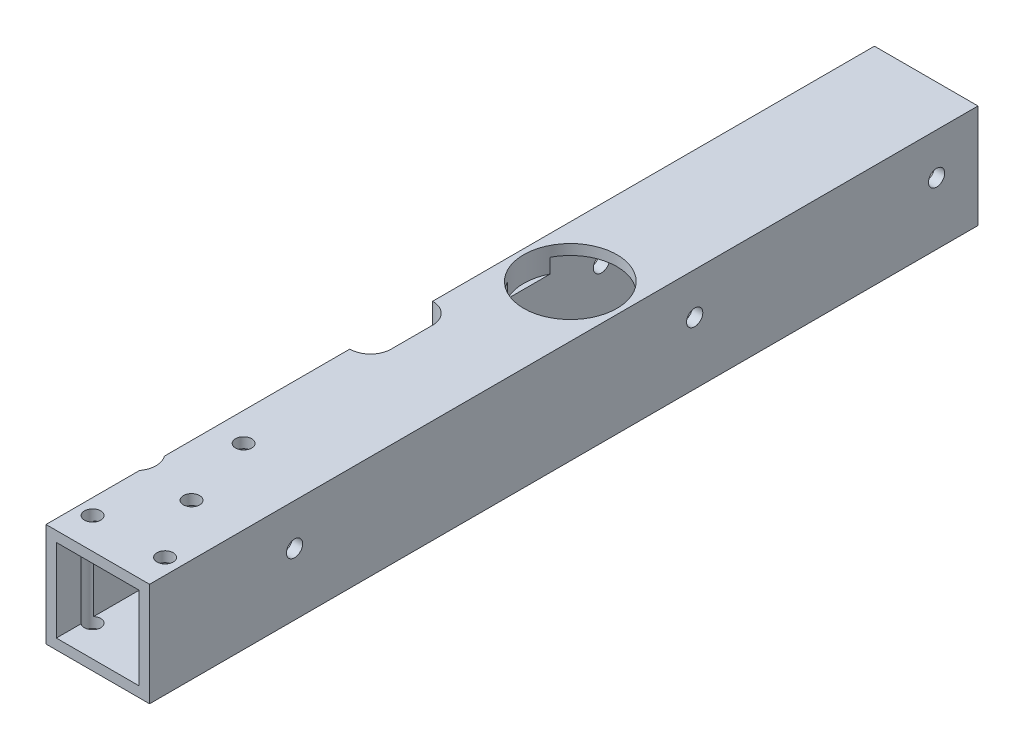
from build123d import *

# Parameters (mm, degrees)
BOSS_EXTRUDE1_DEPTH      = 127
BOSS_EXTRUDE1_DEPTH_BACK = 127
SKETCH3_W                = 31.75
SKETCH3_H                = 31.75
SKETCH3_W_2              = 25.4
SKETCH3_H_2              = 25.4
F_10_CLEARANCE_HOLE1_D   = 4.9784
SKETCH7_R                = 14.2875
CUT_EXTRUDE1_DEPTH       = 7.62
CUT_EXTRUDE2_START       = -7.62
SKETCH8_R                = 14.2875
CUT_EXTRUDE2_DEPTH       = 7.62
CUT_EXTRUDE3_DEPTH       = 132.867653824
F_10_CLEARANCE_HOLE2_D   = 4.9784
SKETCH13_R               = 6.35
CUT_EXTRUDE4_DEPTH       = 132.867653824


with BuildPart() as part:
    # Sketch3 → Boss-Extrude1 (new, two sides: drawn at the far end of the back side and taken through both)
    with BuildSketch(Plane.XY.offset(-BOSS_EXTRUDE1_DEPTH_BACK)):
        Rectangle(SKETCH3_W, SKETCH3_H)
        Rectangle(SKETCH3_W_2, SKETCH3_H_2, mode=Mode.SUBTRACT)
    extrude(amount=BOSS_EXTRUDE1_DEPTH + BOSS_EXTRUDE1_DEPTH_BACK)

    # #10 Clearance Hole1 (through all)
    with Locations(Plane(origin=(0, 15.875, 0), x_dir=(1, 0, 0), z_dir=(0, 1, 0))):
        with Locations((-11.1125, -117.475), (11.1125, -117.475), (0, -98.247200001), (-7.111939052, -75.171256705)):
            Hole(F_10_CLEARANCE_HOLE1_D / 2)

    # Sketch7 → Cut-Extrude1 (cut)
    with BuildSketch(Plane(origin=(0, 15.875, 0), x_dir=(1, 0, 0), z_dir=(0, 1, 0))):
        with Locations(Location((0, 17.8816, 0), (0, 0, 270))):
            Circle(SKETCH7_R)
    extrude(amount=-CUT_EXTRUDE1_DEPTH, mode=Mode.SUBTRACT)

    # Sketch8 → Cut-Extrude2 (cut)
    with BuildSketch(Plane.XZ.offset(15.875).offset(CUT_EXTRUDE2_START)):
        with Locations(Location((0, -17.8816, 0), (0, 0, 90))):
            Circle(SKETCH8_R)
    extrude(amount=CUT_EXTRUDE2_DEPTH, mode=Mode.SUBTRACT)

    # Sketch9 → Cut-Extrude3 (cut, through all)
    with BuildSketch(Plane.XZ.offset(15.875)):
        with BuildLine():
            Line((-9.525, 27.51353779), (-9.525, 14.81353779))
            ThreePointArc((-9.525, 14.81353779), (-11.384871939, 10.323409729), (-15.875, 8.46353779))
            Line((-15.875, 8.46353779), (-15.875, 33.86353779))
            ThreePointArc((-15.875, 33.86353779), (-11.384871939, 32.00366585), (-9.525, 27.51353779))
        make_face()
    extrude(amount=-CUT_EXTRUDE3_DEPTH, mode=Mode.SUBTRACT)

    # #10 Clearance Hole2 (through all)
    with Locations(Plane(origin=(15.875, 0, 0), x_dir=(0, 0, -1), z_dir=(1, 0, 0))):
        with Locations((-82.55, 3.175), (114.3, 3.175), (40.132, 3.175)):
            Hole(F_10_CLEARANCE_HOLE2_D / 2)

    # Sketch13 → Cut-Extrude4 (cut, through all)
    with BuildSketch(Plane.XZ.offset(15.875)):
        with Locations((-20.955, 94.525686877)):
            Circle(SKETCH13_R)
    extrude(amount=-CUT_EXTRUDE4_DEPTH, mode=Mode.SUBTRACT)


solid = part.part
